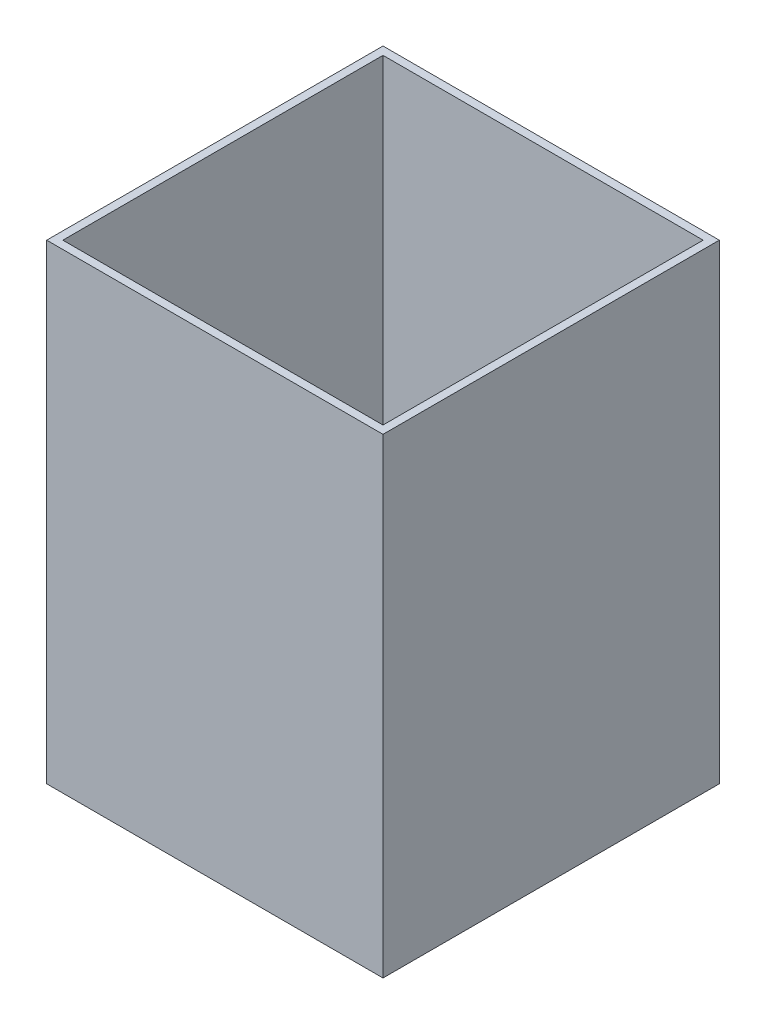
from build123d import *

# Parameters (mm, degrees)
SKETCH1_W           = 250
SKETCH1_H           = 250
BOSS_EXTRUDE1_DEPTH = 350
SKETCH2_W           = 238
SKETCH2_H           = 238
CUT_EXTRUDE1_DEPTH  = 393.109678534


with BuildPart() as part:
    # Sketch1 → Boss-Extrude1 (new body)
    with BuildSketch(Plane(origin=(0, 0, 0), x_dir=(1, 0, 0), z_dir=(0, 1, 0))):
        Rectangle(SKETCH1_W, SKETCH1_H)
    extrude(amount=BOSS_EXTRUDE1_DEPTH)

    # Sketch2 → Cut-Extrude1 (cut, through all)
    with BuildSketch(Plane(origin=(0, 350, 0), x_dir=(1, 0, 0), z_dir=(0, 1, 0))):
        Rectangle(SKETCH2_W, SKETCH2_H)
    extrude(amount=-CUT_EXTRUDE1_DEPTH, mode=Mode.SUBTRACT)


solid = part.part
